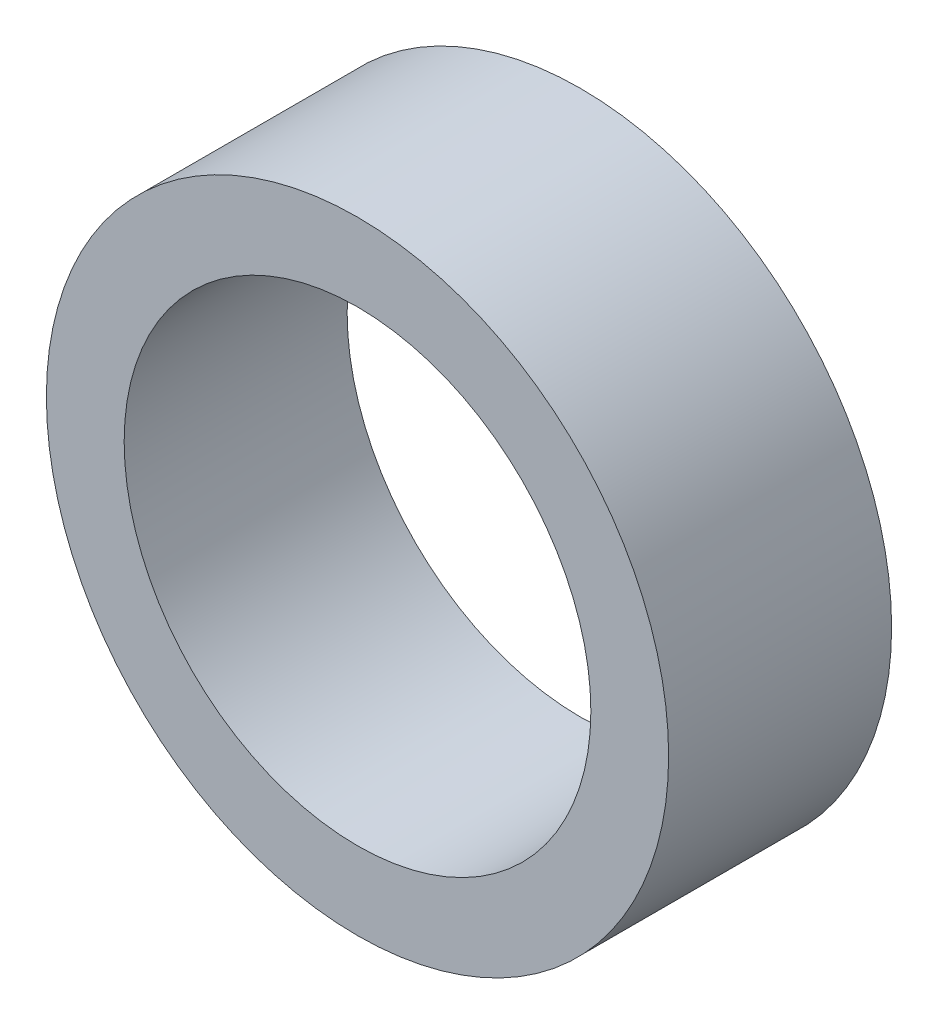
from build123d import *

# Parameters (mm, degrees)
ESQUISSE1_R        = 3
ESQUISSE1_R_2      = 2.25
BOSS_EXTRU_1_DEPTH = 2.15


with BuildPart() as part:
    # Esquisse1 → Boss.-Extru.1 (new body)
    with BuildSketch(Plane.XY):
        with Locations(Location((0, 0, 0), (0, 0, 180))):
            Circle(ESQUISSE1_R)
        with Locations(Location((0, 0, 0), (0, 0, 180))):
            Circle(ESQUISSE1_R_2, mode=Mode.SUBTRACT)
    extrude(amount=BOSS_EXTRU_1_DEPTH)


solid = part.part
